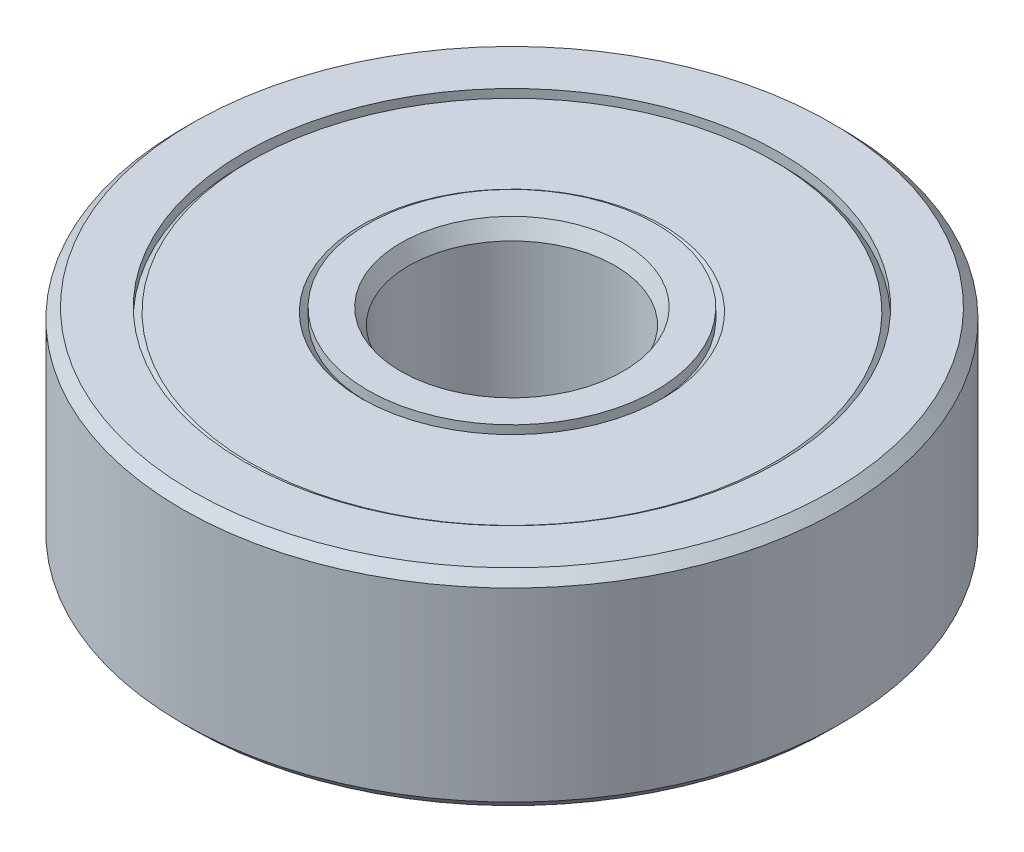
from build123d import *

# Parameters (mm, degrees)
SKETCH_1_R        = 8
SKETCH_1_R_2      = 6.5
EXTRUDE_1_DEPTH   = 5
SKETCH_1_R_3      = 3.5
SKETCH_1_R_4      = 2.5
EXTRUDE_1_2_DEPTH = 5
EXTRUDE_START     = 0.1
SKETCH_1_3_R      = 6.5
SKETCH_1_3_R_2    = 3.5
EXTRUDE_2_DEPTH   = 4.8
CHAMFER_1_SIZE    = 0.25
CHAMFER_2_SIZE    = 0.2
CHAMFER_2_SIZE2   = 0.376145293
CHAMFER_3_SIZE    = 0.15
CHAMFER_4_SIZE    = 0.2
CHAMFER_4_SIZE2   = 0.376145293


with BuildPart() as part:
    # Эскиз1 → Бобышка-Вытянуть1 (new body)
    with BuildSketch(Plane(origin=(0, 0, 0), x_dir=(1, 0, 0), z_dir=(0, 1, 0))):
        Circle(SKETCH_1_R)
        Circle(SKETCH_1_R_2, mode=Mode.SUBTRACT)
    extrude(amount=EXTRUDE_1_DEPTH)

    # Фаска1
    chamfer_1_edges = [part.edges().sort_by_distance(p)[0] for p in [
        (-8, 0, 0),
        (-8, 5, 0),
    ]]
    chamfer(chamfer_1_edges, length=CHAMFER_1_SIZE)


with BuildPart() as body_2:
    # Эскиз1 → Extrude 1 2 (new body)
    with BuildSketch(Plane(origin=(0, 0, 0), x_dir=(1, 0, 0), z_dir=(0, 1, 0))):
        Circle(SKETCH_1_R_3)
        Circle(SKETCH_1_R_4, mode=Mode.SUBTRACT)
    extrude(amount=EXTRUDE_1_2_DEPTH)

    # Фаска2
    chamfer_2_edges = [body_2.edges().sort_by_distance(p)[0] for p in [
        (-2.5, 5, 0),
    ]]
    chamfer_2_side = [body_2.faces().sort_by_distance(p)[0] for p in [
        (-3.401005051, 5, 0),
    ]]
    chamfer(chamfer_2_edges, length=CHAMFER_2_SIZE, length2=CHAMFER_2_SIZE2, reference=chamfer_2_side[0])

    # Фаска4
    chamfer_4_edges = [body_2.edges().sort_by_distance(p)[0] for p in [
        (-2.5, 0, 0),
    ]]
    chamfer_4_side = [body_2.faces().sort_by_distance(p)[0] for p in [
        (-3.401005051, 0, 0),
    ]]
    chamfer(chamfer_4_edges, length=CHAMFER_4_SIZE, length2=CHAMFER_4_SIZE2, reference=chamfer_4_side[0])


with BuildPart() as body_3:
    # Эскиз1<3> → Бобышка-Вытянуть2 (new body)
    with BuildSketch(Plane(origin=(0, 0, 0), x_dir=(1, 0, 0), z_dir=(0, 1, 0)).offset(EXTRUDE_START)):
        Circle(SKETCH_1_3_R)
        Circle(SKETCH_1_3_R_2, mode=Mode.SUBTRACT)
    extrude(amount=EXTRUDE_2_DEPTH)

    # Фаска3
    chamfer_3_edges = [body_3.edges().sort_by_distance(p)[0] for p in [
        (-6.5, 0.1, 0),
        (-3.5, 0.1, 0),
        (-6.5, 4.9, 0),
        (-3.5, 4.9, 0),
    ]]
    chamfer(chamfer_3_edges, length=CHAMFER_3_SIZE)


solid = Compound([part.part, body_2.part, body_3.part])
